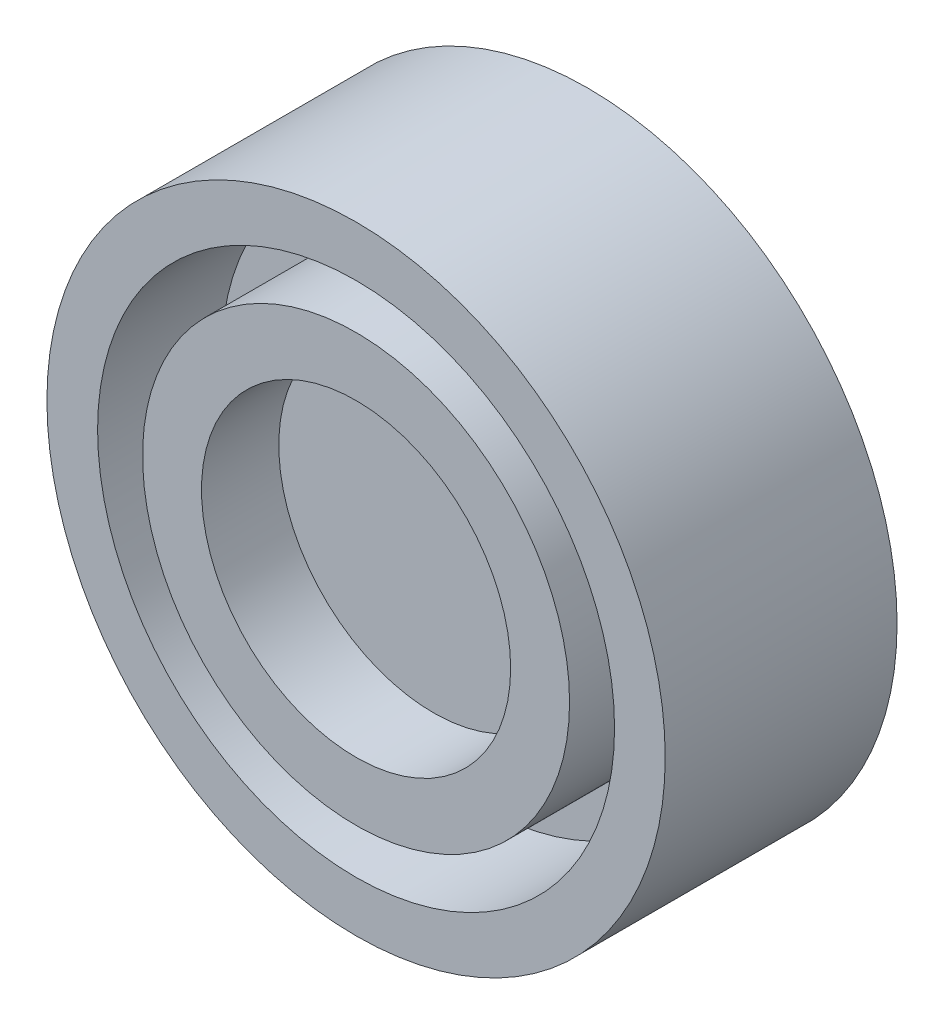
from build123d import *

# Parameters (mm, degrees)
SKETCH1_R           = 20
BOSS_EXTRUDE1_DEPTH = 15
SKETCH2_R           = 10
CUT_EXTRUDE1_DEPTH  = 5
SKETCH3_R           = 16.72234691
SKETCH3_R_2         = 13.811619035
CUT_EXTRUDE2_DEPTH  = 8


with BuildPart() as part:
    # Sketch1 → Boss-Extrude1 (new body)
    with BuildSketch(Plane.XY):
        Circle(SKETCH1_R)
    extrude(amount=BOSS_EXTRUDE1_DEPTH)

    # Sketch2 → Cut-Extrude1 (cut)
    with BuildSketch(Plane.XY.offset(15)):
        Circle(SKETCH2_R)
    extrude(amount=-CUT_EXTRUDE1_DEPTH, mode=Mode.SUBTRACT)

    # Sketch3 → Cut-Extrude2 (cut)
    with BuildSketch(Plane.XY.offset(15)):
        Circle(SKETCH3_R)
        Circle(SKETCH3_R_2, mode=Mode.SUBTRACT)
    extrude(amount=-CUT_EXTRUDE2_DEPTH, mode=Mode.SUBTRACT)


solid = part.part
